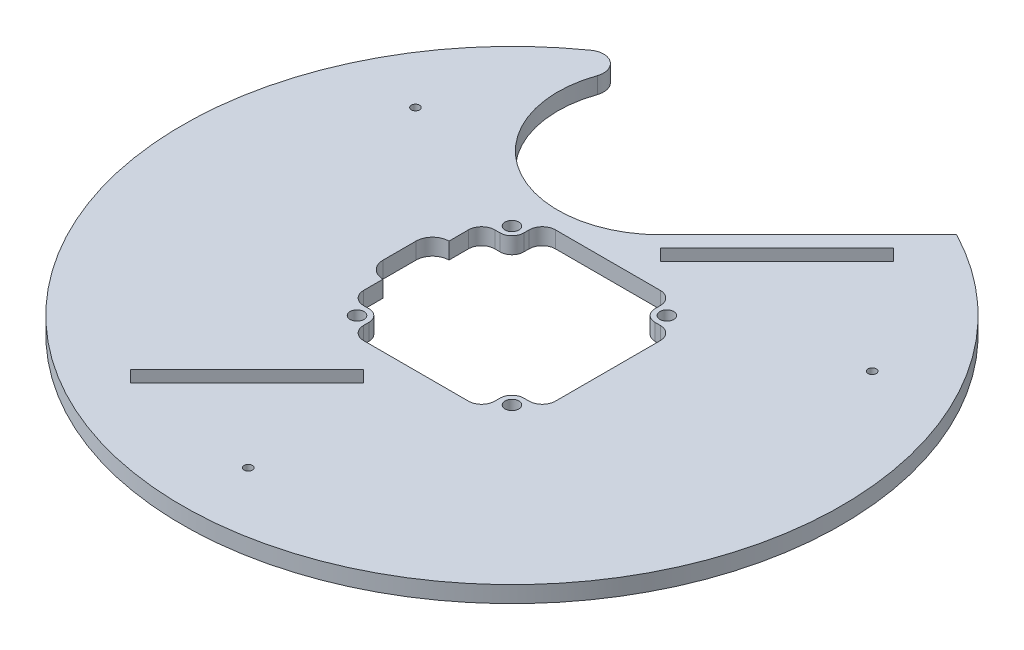
from build123d import *

# Parameters (mm, degrees)
EXTRUDE_1_DEPTH          = 5
CUT_EXTRUDE_1_DEPTH      = 142.509716981
CUT_EXTRUDE_1_DEPTH_BACK = 142.509716981
HOLE_WIZARD_M5_1_D       = 4.2
HOLE_WIZARD_M3_1_D       = 2.5


with BuildPart() as part:
    # 草圖1 → 填料-伸長1 (new body)
    with BuildSketch(Plane(origin=(0, 0, 0), x_dir=(1, 0, 0), z_dir=(0, 1, 0))):
        with BuildLine():
            Line((46.240484381, 88.666891252), (1.290175475, 43.716582347))
            ThreePointArc((1.290175475, 43.716582347), (-37.241511516, 39.366784953), (-50.07196053, 75.95901388))
            ThreePointArc((-50.07196053, 75.95901388), (-51.783240076, 81.599208584), (-57.67661441, 81.690930648))
            ThreePointArc((-57.67661441, 81.690930648), (6.697930583, -99.775436486), (46.240484381, 88.666891252))
        make_face()
        Polygon((-40.181048441, -75.5363875), (-43.716582347, -72.000853594), (-8.361243287, -36.645514535), (-4.825709381, -40.181048441), align=None, mode=Mode.SUBTRACT)
        with BuildLine():
            ThreePointArc((-23.499999452, 19.89891353), (-20.953647337, 20.953647337), (-19.89891353, 23.499999452))
            Line((-19.89891353, 23.499999452), (-19.898913286, 25.100000259))
            ThreePointArc((-19.898913286, 25.100000259), (-18.727340196, 27.92842699), (-15.898913286, 29.09999965))
            Line((-15.898913286, 29.09999965), (15.898913286, 29.09999965))
            ThreePointArc((15.898913286, 29.09999965), (18.727340196, 27.92842699), (19.898913286, 25.100000259))
            Line((19.898913286, 25.100000259), (19.89891353, 23.499999452))
            ThreePointArc((19.89891353, 23.499999452), (20.953647337, 20.953647337), (23.499999452, 19.89891353))
            Line((23.499999452, 19.89891353), (25.100000259, 19.898913286))
            ThreePointArc((25.100000259, 19.898913286), (27.92842699, 18.727340196), (29.09999965, 15.898913286))
            Line((29.09999965, 15.898913286), (29.09999965, -15.898913286))
            ThreePointArc((29.09999965, -15.898913286), (27.92842699, -18.727340196), (25.100000259, -19.898913286))
            Line((25.100000259, -19.898913286), (23.499999452, -19.89891353))
            ThreePointArc((23.499999452, -19.89891353), (20.953647337, -20.953647337), (19.89891353, -23.499999452))
            Line((19.89891353, -23.499999452), (19.898913286, -25.100000259))
            ThreePointArc((19.898913286, -25.100000259), (18.727340196, -27.92842699), (15.898913286, -29.09999965))
            Line((15.898913286, -29.09999965), (-15.898913286, -29.09999965))
            ThreePointArc((-15.898913286, -29.09999965), (-18.727340196, -27.92842699), (-19.898913286, -25.100000259))
            Line((-19.898913286, -25.100000259), (-19.89891353, -23.499999452))
            ThreePointArc((-19.89891353, -23.499999452), (-20.953647337, -20.953647337), (-23.499999452, -19.89891353))
            Line((-23.499999452, -19.89891353), (-25.100000259, -19.898913286))
            ThreePointArc((-25.100000259, -19.898913286), (-27.92842699, -18.727340196), (-29.09999965, -15.898913286))
            Line((-29.09999965, -15.898913286), (-29.09999965, 15.898913286))
            ThreePointArc((-29.09999965, 15.898913286), (-27.92842699, 18.727340196), (-25.100000259, 19.898913286))
            Line((-25.100000259, 19.898913286), (-23.499999452, 19.89891353))
        make_face(mode=Mode.SUBTRACT)
        Polygon((43.716582347, 72.000853594), (8.361243287, 36.645514535), (4.825709381, 40.181048441), (40.181048441, 75.5363875), align=None, mode=Mode.SUBTRACT)
    extrude(amount=-EXTRUDE_1_DEPTH)

    # 草圖5 → 除料-伸長1 (cut, two sides: drawn at the far end of the back side and taken through both)
    with BuildSketch(Plane(origin=(0, 0, 0), x_dir=(1, 0, 0), z_dir=(0, 1, 0)).offset(-CUT_EXTRUDE_1_DEPTH_BACK)):
        with BuildLine():
            Line((-34.09999965, -5), (-34.09999965, 5))
            ThreePointArc((-34.09999965, 5), (-29.09999965, 10), (-24.09999965, 5))
            Line((-24.09999965, 5), (-24.09999965, -5))
            ThreePointArc((-24.09999965, -5), (-29.09999965, -10), (-34.09999965, -5))
        make_face()
    extrude(amount=CUT_EXTRUDE_1_DEPTH + CUT_EXTRUDE_1_DEPTH_BACK, mode=Mode.SUBTRACT)

    # M5  螺絲攻的螺孔鑽1 (through all)
    with Locations(Plane(origin=(0, 0, 0), x_dir=(1, 0, 0), z_dir=(0, 1, 0))):
        with Locations((23.5, 23.5), (23.5, -23.5), (-23.5, -23.5), (-23.5, 23.5)):
            Hole(HOLE_WIZARD_M5_1_D / 2)

    # M3  螺絲攻的螺孔鑽1 (through all)
    with Locations(Plane(origin=(0, 0, 0), x_dir=(1, 0, 0), z_dir=(0, 1, 0))):
        with Locations((-69.282032303, 40), (0, -80), (69.282032303, 40)):
            Hole(HOLE_WIZARD_M3_1_D / 2)


solid = part.part
